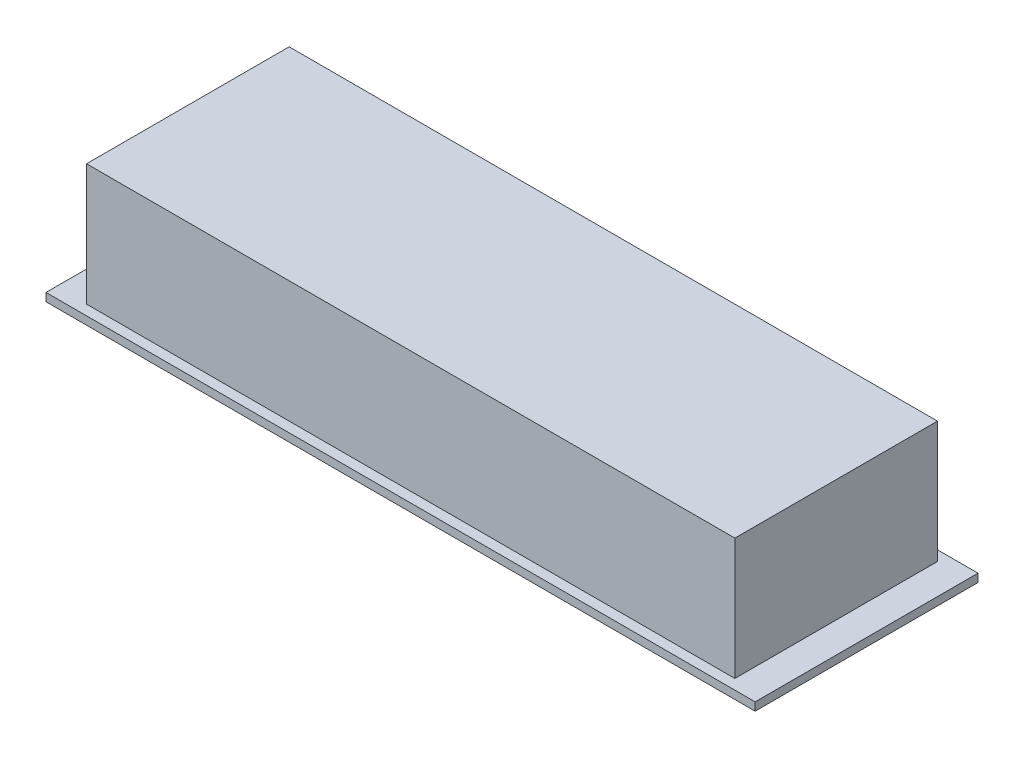
from build123d import *

# Parameters (mm, degrees)
SKETCH1_W           = 203.2
SKETCH1_H           = 63.5
BOSS_EXTRUDE1_DEPTH = 38.1
SKETCH2_W           = 222.25
SKETCH2_H           = 69.85
BOSS_EXTRUDE2_DEPTH = 2.54


with BuildPart() as part:
    # Sketch1 → Boss-Extrude1 (new body)
    with BuildSketch(Plane(origin=(0, 0, 0), x_dir=(1, 0, 0), z_dir=(0, 1, 0))):
        Rectangle(SKETCH1_W, SKETCH1_H)
    extrude(amount=BOSS_EXTRUDE1_DEPTH)

    # Sketch2 → Boss-Extrude2 (add)
    with BuildSketch(Plane.XZ):
        Rectangle(SKETCH2_W, SKETCH2_H)
    extrude(amount=BOSS_EXTRUDE2_DEPTH)


solid = part.part
